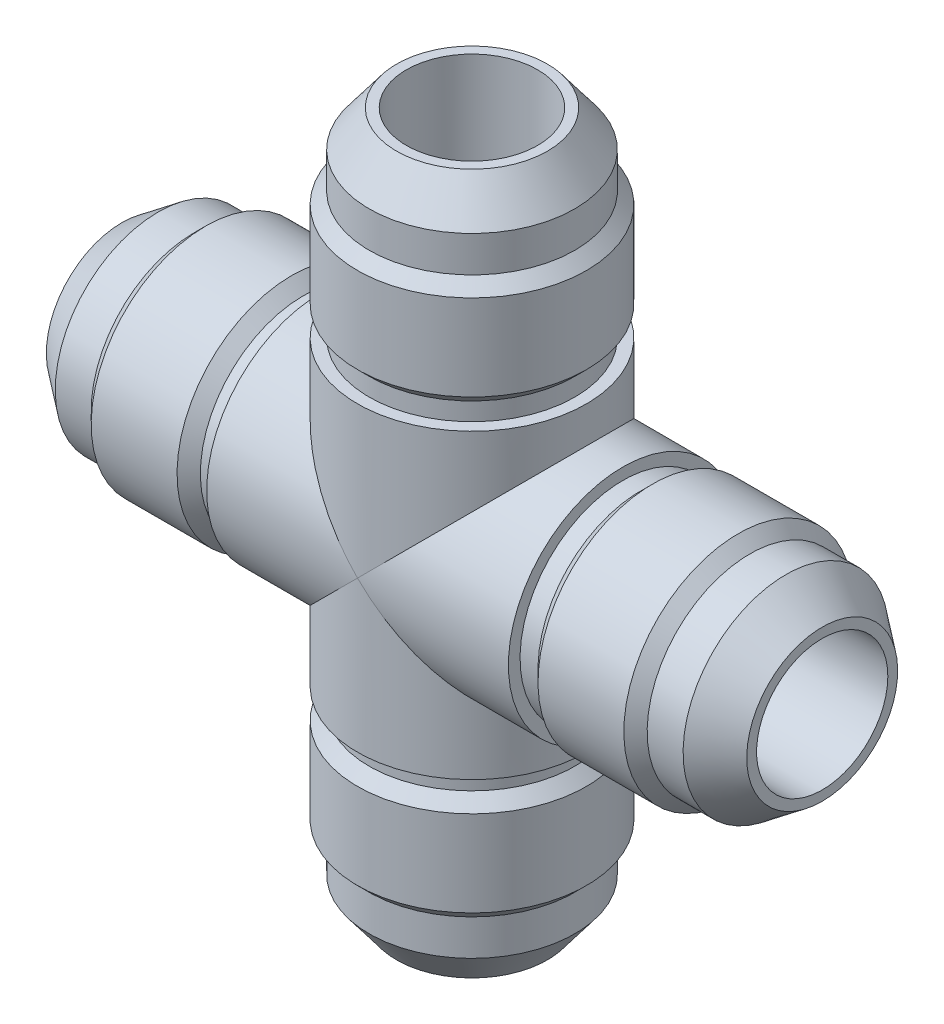
from build123d import *
from build123d.topology import SkipClean

# Parameters (mm, degrees)
SKETCH2_R               = 13.49375
EXTRUDE1_DEPTH          = 23.495
SKETCH15_R              = 13.49375
BOSS_EXTRUDE1_DEPTH     = 17.78
SKETCH16_R              = 7.7343
CUT_EXTRUDE1_DEPTH      = 46.47293924
CIRPATTERN1_COUNT       = 4
CIRPATTERN1_ANGLE       = 270
SKETCH17_R              = 7.7343
CUT_EXTRUDE2_DEPTH      = 94.274913101
CUT_EXTRUDE3_REACH      = 95.275
SKETCH18_R              = 7.7343
CUT_EXTRUDE4_DEPTH      = 60.911038679
CUT_EXTRUDE4_DEPTH_BACK = 60.911038679
SKETCH19_R              = 7.7343
CUT_EXTRUDE5_DEPTH      = 60.911038679
CUT_EXTRUDE5_DEPTH_BACK = 60.911038679
SKETCH20_R              = 7.7343


with BuildPart() as part:
    # Sketch2 → Extrude1 (new body)
    with BuildSketch(Plane(origin=(-41.275, 0, 0), x_dir=(0, 0, -1), z_dir=(1, 0, 0))):
        Circle(SKETCH2_R)
    extrude(amount=EXTRUDE1_DEPTH)

    # Sketch5 → Cut-Revolve1 (revolve, cut)
    with BuildSketch(Plane.XY):
        Polygon((-36.995957679, 12.118934671), (-32.762624346, 12.118934671), (-31.387809017, 13.49375), (-41.275, 13.49375), (-41.275, 8.894445), align=None)
        Polygon((-17.78, 12.118934671), (-19.896666667, 12.118934671), (-21.271481995, 13.49375), (-17.78, 13.49375), align=None)
    revolve(axis=Axis((0, 0, 0), (-1, 0, 0)), mode=Mode.SUBTRACT)

    # Sketch15 → Boss-Extrude1 (add)
    with BuildSketch(Plane(origin=(-17.78, 0, 0), x_dir=(0, 0, -1), z_dir=(1, 0, 0))):
        with Locations(Location((0, 0, 0), (0, 0, 90))):
            Circle(SKETCH15_R)
    extrude(amount=BOSS_EXTRUDE1_DEPTH)

    # Sketch16 → Cut-Extrude1 (cut, through all)
    with BuildSketch(Plane(origin=(0, 0, 0), x_dir=(0, 0, -1), z_dir=(1, 0, 0))):
        Circle(SKETCH16_R)
    extrude(amount=-CUT_EXTRUDE1_DEPTH, mode=Mode.SUBTRACT)


with BuildPart() as cirpattern1_1:
    # CirPattern1: pattern copy
    add(part.part.rotate(Axis((0, 0, 0), (0, 0, -1)), 1 * CIRPATTERN1_ANGLE / (CIRPATTERN1_COUNT - 1)))

    # Sketch17 → Cut-Extrude2 (cut, through all)
    with BuildSketch(Plane.ZY.offset(41.275)):
        with Locations(Location((0, 0, 0), (0, 0, 180))):
            Circle(SKETCH17_R)
    extrude(amount=-CUT_EXTRUDE2_DEPTH, mode=Mode.SUBTRACT)


with BuildPart() as cirpattern1_2:
    # CirPattern1: pattern copy
    add(part.part.rotate(Axis((0, 0, 0), (0, 0, -1)), 2 * CIRPATTERN1_ANGLE / (CIRPATTERN1_COUNT - 1)))


with BuildPart() as cirpattern1_3:
    # CirPattern1: pattern copy
    add(part.part.rotate(Axis((0, 0, 0), (0, 0, -1)), 3 * CIRPATTERN1_ANGLE / (CIRPATTERN1_COUNT - 1)))


with BuildPart() as cirpattern1_1_1:
    add(cirpattern1_1.part)

    # Combine1: union part, CirPattern1_2, CirPattern1_3
    add(part.part)
    add(cirpattern1_2.part)
    add(cirpattern1_3.part)

    # Sketch18 → Cut-Extrude3 (cut, up to next)
    with BuildSketch(Plane(origin=(0, 41.275, 0), x_dir=(1, 0, 0), z_dir=(0, 1, 0)), mode=Mode.PRIVATE) as cut_extrude3_sk1:
        with Locations(Location((0, 0, 0), (0, 0, 90))):
            Circle(SKETCH18_R)
    cut_extrude3_tool1 = extrude(cut_extrude3_sk1.sketch, amount=-CUT_EXTRUDE3_REACH, mode=Mode.PRIVATE) & cirpattern1_1_1.part
    add(cut_extrude3_tool1.solids().sort_by_distance((0, 41.275, 0))[0], mode=Mode.SUBTRACT)

    # Sketch19 → Cut-Extrude4 (cut, two sides: drawn at the far end of the back side and taken through both)
    with SkipClean():  # the faces are left unmerged after this step: merging them gives an invalid solid
        with BuildSketch(Plane(origin=(0, 0, 0), x_dir=(0, 0, -1), z_dir=(1, 0, 0)).offset(-CUT_EXTRUDE4_DEPTH_BACK)):
            Circle(SKETCH19_R)
        extrude(amount=CUT_EXTRUDE4_DEPTH + CUT_EXTRUDE4_DEPTH_BACK, mode=Mode.SUBTRACT)

    # Sketch20 → Cut-Extrude5 (cut, two sides: drawn at the far end of the back side and taken through both)
    with BuildSketch(Plane(origin=(0, 0, 0), x_dir=(1, 0, 0), z_dir=(0, 1, 0)).offset(-CUT_EXTRUDE5_DEPTH_BACK)):
        with Locations(Location((0, 0, 0), (0, 0, 90))):
            Circle(SKETCH20_R)
    extrude(amount=CUT_EXTRUDE5_DEPTH + CUT_EXTRUDE5_DEPTH_BACK, mode=Mode.SUBTRACT)


solid = cirpattern1_1_1.part
